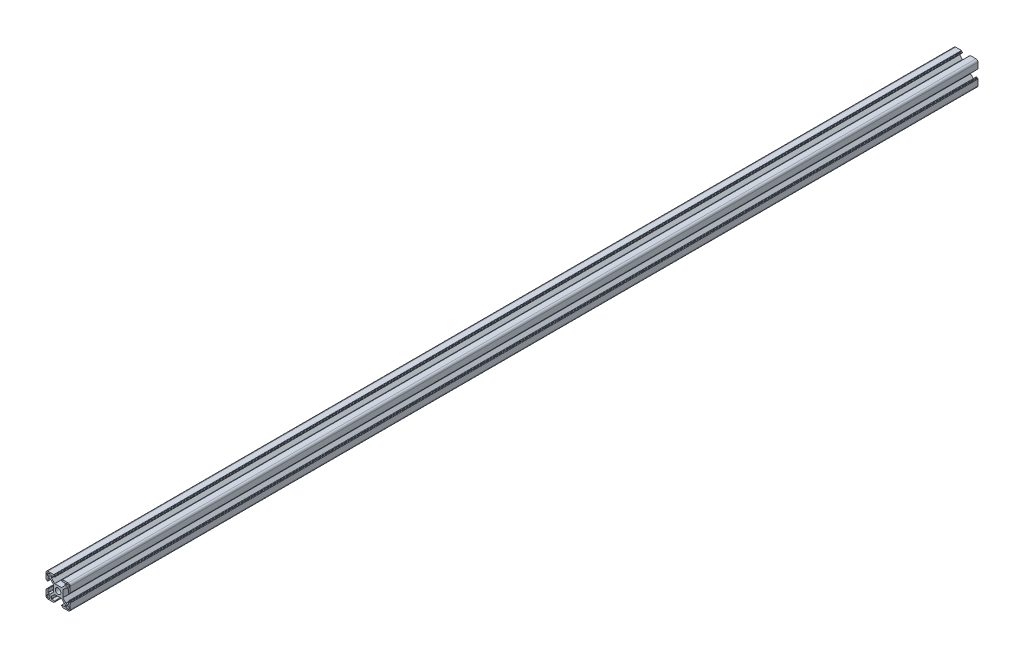
from build123d import *

# Parameters (mm, degrees)
MODEL_R             = 6.8
BOSS_EXTRUDE1_DEPTH = 2250
SCALE1_SCALE        = 0.333333333


with BuildPart() as part:
    # Model → Boss-Extrude1 (new body)
    with BuildSketch(Plane.XY):
        with BuildLine():
            Line((0, 11.6), (-8.240202025, 11.6))
            ThreePointArc((-8.240202025, 11.6), (-8.469812085, 11.64567228), (-8.664466094, 11.775735931))
            Line((-8.664466094, 11.775735931), (-16.324264069, 19.435533906))
            ThreePointArc((-16.324264069, 19.435533906), (-16.45432772, 19.630187915), (-16.5, 19.859797975))
            Line((-16.5, 19.859797975), (-16.5, 25))
            ThreePointArc((-16.5, 25), (-16.324264069, 25.424264069), (-15.9, 25.6))
            Line((-15.9, 25.6), (-8.8, 25.6))
            ThreePointArc((-8.8, 25.6), (-8.375735931, 25.775735931), (-8.2, 26.2))
            Line((-8.2, 26.2), (-8.2, 27.4))
            ThreePointArc((-8.2, 27.4), (-8.375735931, 27.824264069), (-8.8, 28))
            Line((-8.8, 28), (-9.8, 28))
            ThreePointArc((-9.8, 28), (-10.224264069, 28.175735931), (-10.4, 28.6))
            Line((-10.4, 28.6), (-10.4, 29.4))
            ThreePointArc((-10.4, 29.4), (-10.575735931, 29.824264069), (-10.999999999, 30))
            Line((-10.999999999, 30), (-25, 30))
            ThreePointArc((-25, 30), (-28.535533906, 28.535533906), (-30, 25))
            Line((-30, 25), (-30, 11))
            ThreePointArc((-30, 11), (-29.824264069, 10.575735931), (-29.4, 10.4))
            Line((-29.4, 10.4), (-28.6, 10.4))
            ThreePointArc((-28.6, 10.4), (-28.175735931, 10.224264069), (-28, 9.8))
            Line((-28, 9.8), (-28, 8.8))
            ThreePointArc((-28, 8.8), (-27.824264069, 8.375735931), (-27.4, 8.2))
            Line((-27.4, 8.2), (-26.2, 8.2))
            ThreePointArc((-26.2, 8.2), (-25.775735931, 8.375735931), (-25.6, 8.8))
            Line((-25.6, 8.8), (-25.6, 15.9))
            ThreePointArc((-25.6, 15.9), (-25.424264069, 16.324264069), (-25, 16.5))
            Line((-25, 16.5), (-19.859797974, 16.5))
            ThreePointArc((-19.859797974, 16.5), (-19.630187915, 16.454327719), (-19.435533906, 16.324264068))
            Line((-19.435533906, 16.324264068), (-11.775735931, 8.664466094))
            ThreePointArc((-11.775735931, 8.664466094), (-11.64567228, 8.469812085), (-11.6, 8.240202025))
            Line((-11.6, 8.240202025), (-11.6, 0))
            Line((-11.6, 0), (-11.6, -8.240202025))
            ThreePointArc((-11.6, -8.240202025), (-11.64567228, -8.469812085), (-11.775735931, -8.664466094))
            Line((-11.775735931, -8.664466094), (-19.435533906, -16.324264068))
            ThreePointArc((-19.435533906, -16.324264068), (-19.630187915, -16.454327719), (-19.859797974, -16.5))
            Line((-19.859797974, -16.5), (-25, -16.5))
            ThreePointArc((-25, -16.5), (-25.424264069, -16.324264069), (-25.6, -15.9))
            Line((-25.6, -15.9), (-25.6, -8.8))
            ThreePointArc((-25.6, -8.8), (-25.775735931, -8.375735931), (-26.2, -8.2))
            Line((-26.2, -8.2), (-27.4, -8.2))
            ThreePointArc((-27.4, -8.2), (-27.824264069, -8.375735931), (-28, -8.8))
            Line((-28, -8.8), (-28, -9.8))
            ThreePointArc((-28, -9.8), (-28.175735931, -10.224264069), (-28.6, -10.4))
            Line((-28.6, -10.4), (-29.4, -10.4))
            ThreePointArc((-29.4, -10.4), (-29.824264069, -10.575735931), (-30, -11))
            Line((-30, -11), (-30, -25))
            ThreePointArc((-30, -25), (-28.535533906, -28.535533906), (-25, -30))
            Line((-25, -30), (-10.999999999, -30))
            ThreePointArc((-10.999999999, -30), (-10.575735931, -29.824264069), (-10.4, -29.4))
            Line((-10.4, -29.4), (-10.4, -28.6))
            ThreePointArc((-10.4, -28.6), (-10.224264069, -28.175735931), (-9.8, -28))
            Line((-9.8, -28), (-8.8, -28))
            ThreePointArc((-8.8, -28), (-8.375735931, -27.824264069), (-8.2, -27.4))
            Line((-8.2, -27.4), (-8.2, -26.2))
            ThreePointArc((-8.2, -26.2), (-8.375735931, -25.775735931), (-8.8, -25.6))
            Line((-8.8, -25.6), (-15.9, -25.6))
            ThreePointArc((-15.9, -25.6), (-16.324264069, -25.424264069), (-16.5, -25))
            Line((-16.5, -25), (-16.5, -19.859797975))
            ThreePointArc((-16.5, -19.859797975), (-16.45432772, -19.630187915), (-16.324264069, -19.435533906))
            Line((-16.324264069, -19.435533906), (-8.664466094, -11.775735931))
            ThreePointArc((-8.664466094, -11.775735931), (-8.469812085, -11.64567228), (-8.240202025, -11.6))
            Line((-8.240202025, -11.6), (0, -11.6))
            Line((0, -11.6), (8.240202025, -11.6))
            ThreePointArc((8.240202025, -11.6), (8.469812085, -11.64567228), (8.664466094, -11.775735931))
            Line((8.664466094, -11.775735931), (16.324264069, -19.435533906))
            ThreePointArc((16.324264069, -19.435533906), (16.45432772, -19.630187915), (16.5, -19.859797975))
            Line((16.5, -19.859797975), (16.5, -25))
            ThreePointArc((16.5, -25), (16.324264069, -25.424264069), (15.9, -25.6))
            Line((15.9, -25.6), (8.8, -25.6))
            ThreePointArc((8.8, -25.6), (8.375735931, -25.775735931), (8.2, -26.2))
            Line((8.2, -26.2), (8.2, -27.4))
            ThreePointArc((8.2, -27.4), (8.375735931, -27.824264069), (8.8, -28))
            Line((8.8, -28), (9.8, -28))
            ThreePointArc((9.8, -28), (10.224264069, -28.175735931), (10.4, -28.6))
            Line((10.4, -28.6), (10.4, -29.4))
            ThreePointArc((10.4, -29.4), (10.575735931, -29.824264069), (10.999999999, -30))
            Line((10.999999999, -30), (25, -30))
            ThreePointArc((25, -30), (28.535533906, -28.535533906), (30, -25))
            Line((30, -25), (30, -11))
            ThreePointArc((30, -11), (29.824264069, -10.575735931), (29.4, -10.4))
            Line((29.4, -10.4), (28.6, -10.4))
            ThreePointArc((28.6, -10.4), (28.175735931, -10.224264069), (28, -9.8))
            Line((28, -9.8), (28, -8.8))
            ThreePointArc((28, -8.8), (27.824264069, -8.375735931), (27.4, -8.2))
            Line((27.4, -8.2), (26.2, -8.2))
            ThreePointArc((26.2, -8.2), (25.775735931, -8.375735931), (25.6, -8.8))
            Line((25.6, -8.8), (25.6, -15.9))
            ThreePointArc((25.6, -15.9), (25.424264069, -16.324264069), (25, -16.5))
            Line((25, -16.5), (19.859797974, -16.5))
            ThreePointArc((19.859797974, -16.5), (19.630187915, -16.454327719), (19.435533906, -16.324264068))
            Line((19.435533906, -16.324264068), (11.775735931, -8.664466094))
            ThreePointArc((11.775735931, -8.664466094), (11.64567228, -8.469812085), (11.6, -8.240202025))
            Line((11.6, -8.240202025), (11.6, 0))
            Line((11.6, 0), (11.6, 8.240202025))
            ThreePointArc((11.6, 8.240202025), (11.64567228, 8.469812085), (11.775735931, 8.664466094))
            Line((11.775735931, 8.664466094), (19.611269837, 16.5))
            Line((19.611269837, 16.5), (25, 16.5))
            ThreePointArc((25, 16.5), (25.424264069, 16.324264069), (25.6, 15.9))
            Line((25.6, 15.9), (25.6, 8.8))
            ThreePointArc((25.6, 8.8), (25.775735931, 8.375735931), (26.2, 8.2))
            Line((26.2, 8.2), (27.4, 8.2))
            ThreePointArc((27.4, 8.2), (27.824264069, 8.375735931), (28, 8.8))
            Line((28, 8.8), (28, 9.8))
            ThreePointArc((28, 9.8), (28.175735931, 10.224264069), (28.6, 10.4))
            Line((28.6, 10.4), (29.4, 10.4))
            ThreePointArc((29.4, 10.4), (29.824264069, 10.575735931), (30, 11))
            Line((30, 11), (30, 25))
            ThreePointArc((30, 25), (28.535533906, 28.535533906), (25, 30))
            Line((25, 30), (10.999999999, 30))
            ThreePointArc((10.999999999, 30), (10.575735931, 29.824264069), (10.4, 29.4))
            Line((10.4, 29.4), (10.4, 28.6))
            ThreePointArc((10.4, 28.6), (10.224264069, 28.175735931), (9.8, 28))
            Line((9.8, 28), (8.8, 28))
            ThreePointArc((8.8, 28), (8.375735931, 27.824264069), (8.2, 27.4))
            Line((8.2, 27.4), (8.2, 26.2))
            ThreePointArc((8.2, 26.2), (8.375735931, 25.775735931), (8.8, 25.6))
            Line((8.8, 25.6), (15.9, 25.6))
            ThreePointArc((15.9, 25.6), (16.324264069, 25.424264069), (16.5, 25))
            Line((16.5, 25), (16.5, 19.859797975))
            ThreePointArc((16.5, 19.859797975), (16.45432772, 19.630187915), (16.324264069, 19.435533906))
            Line((16.324264069, 19.435533906), (8.664466094, 11.775735931))
            ThreePointArc((8.664466094, 11.775735931), (8.469812085, 11.64567228), (8.240202025, 11.6))
            Line((8.240202025, 11.6), (0, 11.6))
        make_face()
        Circle(MODEL_R, mode=Mode.SUBTRACT)
        with BuildLine():
            Line((21.5, 27), (25, 27))
            ThreePointArc((25, 27), (26.414213562, 26.414213562), (27, 25))
            Line((27, 25), (27, 21.5))
            ThreePointArc((27, 21.5), (26.414213562, 20.085786438), (25, 19.5))
            Line((25, 19.5), (21.5, 19.5))
            ThreePointArc((21.5, 19.5), (20.085786438, 20.085786438), (19.5, 21.5))
            Line((19.5, 21.5), (19.5, 25))
            ThreePointArc((19.5, 25), (20.085786438, 26.414213562), (21.5, 27))
        make_face(mode=Mode.SUBTRACT)
        with BuildLine():
            Line((21.5, -27), (25, -27))
            ThreePointArc((25, -27), (26.414213562, -26.414213562), (27, -25))
            Line((27, -25), (27, -21.5))
            ThreePointArc((27, -21.5), (26.414213562, -20.085786438), (25, -19.5))
            Line((25, -19.5), (21.5, -19.5))
            ThreePointArc((21.5, -19.5), (20.085786438, -20.085786438), (19.5, -21.5))
            Line((19.5, -21.5), (19.5, -25))
            ThreePointArc((19.5, -25), (20.085786438, -26.414213562), (21.5, -27))
        make_face(mode=Mode.SUBTRACT)
        with BuildLine():
            Line((-21.5, -27), (-25, -27))
            ThreePointArc((-25, -27), (-26.414213562, -26.414213562), (-27, -25))
            Line((-27, -25), (-27, -21.5))
            ThreePointArc((-27, -21.5), (-26.414213562, -20.085786438), (-25, -19.5))
            Line((-25, -19.5), (-21.5, -19.5))
            ThreePointArc((-21.5, -19.5), (-20.085786438, -20.085786438), (-19.5, -21.5))
            Line((-19.5, -21.5), (-19.5, -25))
            ThreePointArc((-19.5, -25), (-20.085786438, -26.414213562), (-21.5, -27))
        make_face(mode=Mode.SUBTRACT)
        with BuildLine():
            Line((-21.5, 27), (-25, 27))
            ThreePointArc((-25, 27), (-26.414213562, 26.414213562), (-27, 25))
            Line((-27, 25), (-27, 21.5))
            ThreePointArc((-27, 21.5), (-26.414213562, 20.085786438), (-25, 19.5))
            Line((-25, 19.5), (-21.5, 19.5))
            ThreePointArc((-21.5, 19.5), (-20.085786438, 20.085786438), (-19.5, 21.5))
            Line((-19.5, 21.5), (-19.5, 25))
            ThreePointArc((-19.5, 25), (-20.085786438, 26.414213562), (-21.5, 27))
        make_face(mode=Mode.SUBTRACT)
    extrude(amount=BOSS_EXTRUDE1_DEPTH)


with BuildPart() as part_1:
    # Scale1: scaled about (-0.000116359, -9.761e-05, 1125)
    add(part.part.scale(SCALE1_SCALE).moved(Location((-7.7573e-05, -6.5073e-05, 750))))


solid = part_1.part
